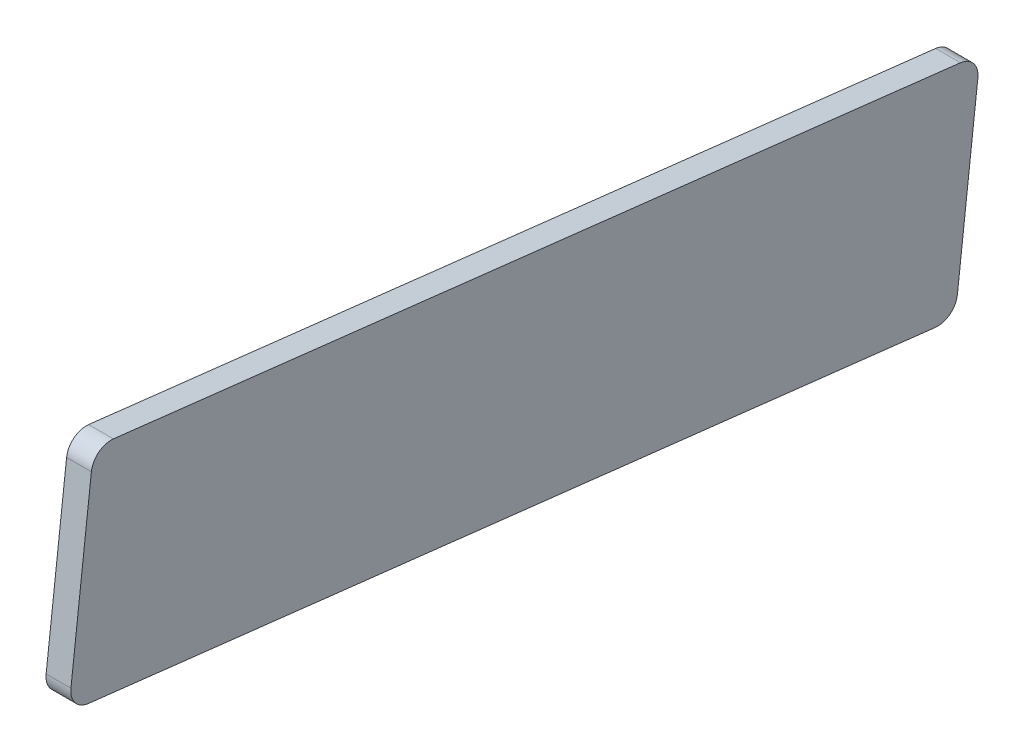
from build123d import *

# Parameters (mm, degrees)
BOSS_EXTRUDE1_DEPTH = 2.5


with BuildPart() as part:
    # Sketch1 → Boss-Extrude1 (new body)
    with BuildSketch(Plane.ZY.offset(230.5)):
        with BuildLine():
            Line((-346.715127801, 353.841707564), (-344.651242875, 335.960421843))
            ThreePointArc((-344.651242875, 335.960421843), (-343.907165724, 334.622701789), (-342.435112803, 334.202932866))
            Line((-342.435112803, 334.202932866), (-257.002303251, 344.063716401))
            ThreePointArc((-257.002303251, 344.063716401), (-255.664583196, 344.807793551), (-255.244814273, 346.279846472))
            Line((-255.244814273, 346.279846472), (-257.308699199, 364.161132193))
            ThreePointArc((-257.308699199, 364.161132193), (-258.05277635, 365.498852247), (-259.524829271, 365.91862117))
            Line((-259.524829271, 365.91862117), (-344.957638824, 356.057837635))
            ThreePointArc((-344.957638824, 356.057837635), (-346.295358878, 355.313760485), (-346.715127801, 353.841707564))
        make_face()
    extrude(amount=BOSS_EXTRUDE1_DEPTH)


solid = part.part
